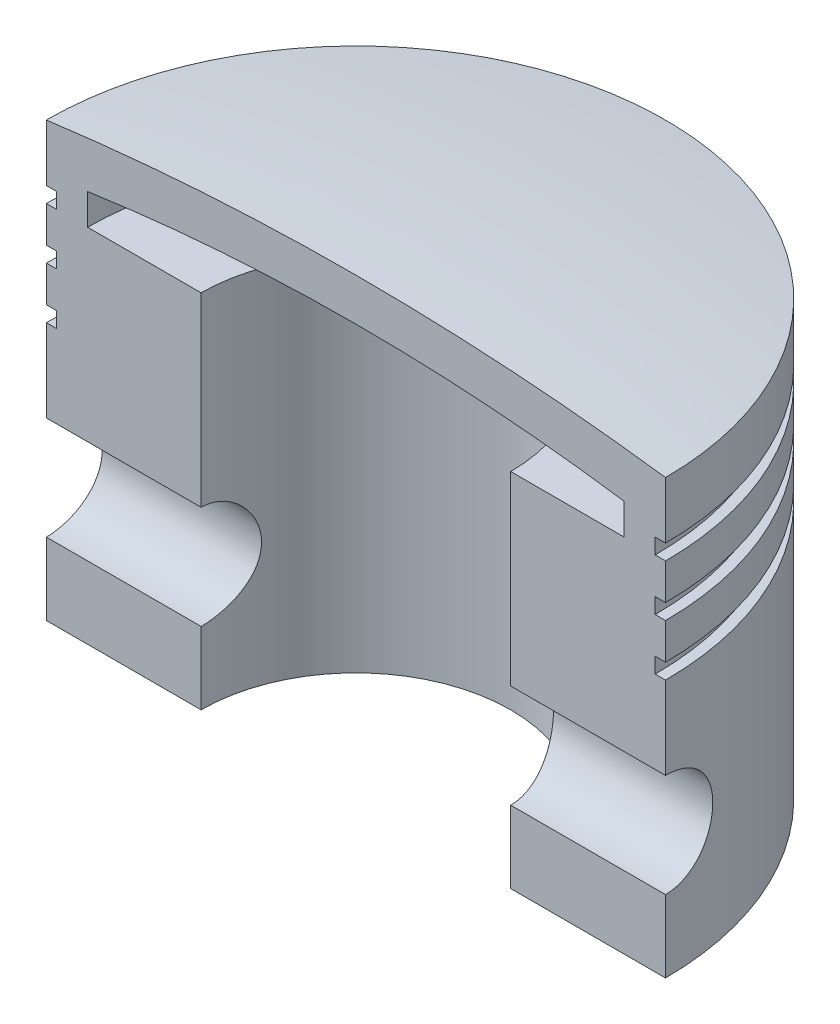
from build123d import *

# Parameters (mm, degrees)
CUT_EXTRUDE1_DEPTH      = 62.112017288
CUT_EXTRUDE1_DEPTH_BACK = 62.112017288
SKETCH2_R               = 5
SKETCH3_W               = 1
SKETCH3_H               = 1.5
SKETCH4_W               = 103.716801646
SKETCH4_H               = 65.276308729
CUT_EXTRUDE2_DEPTH      = 40


with BuildPart() as part:
    # Sketch1 → Revolve2 (revolve)
    with BuildSketch(Plane.XY):
        with BuildLine():
            Line((15, 35), (15, 0))
            Line((15, 0), (30, 0))
            Line((30, 0), (30, 42))
            ThreePointArc((30, 42), (15.03279876, 43.488194683), (0, 43.984982176))
            Line((0, 43.984982176), (0, 39.872478009))
            ThreePointArc((0, 39.872478009), (13.033669609, 39.403753083), (26, 38))
            Line((26, 38), (26, 35))
            Line((26, 35), (15, 35))
        make_face()
    revolve(axis=Axis((0, 45, 0), (0, 1, 0)))

    # Sketch2 → Cut-Extrude1 (cut, two sides: drawn at the far end of the back side and taken through both)
    with BuildSketch(Plane(origin=(0, 0, 0), x_dir=(0, 0, -1), z_dir=(1, 0, 0)).offset(-CUT_EXTRUDE1_DEPTH_BACK)):
        with Locations((0, 12)):
            Circle(SKETCH2_R)
    extrude(amount=CUT_EXTRUDE1_DEPTH + CUT_EXTRUDE1_DEPTH_BACK, mode=Mode.SUBTRACT)

    # Sketch3 → Cut-Revolve1 (revolve, cut)
    with BuildSketch(Plane(origin=(0, 0, 0), x_dir=(0, 0, -1), z_dir=(1, 0, 0))):
        with Locations((29.5, 35.75)):
            Rectangle(SKETCH3_W, SKETCH3_H)
        with Locations((29.5, 30.75)):
            Rectangle(SKETCH3_W, SKETCH3_H)
        with Locations((29.5, 25.75)):
            Rectangle(SKETCH3_W, SKETCH3_H)
    revolve(axis=Axis((0, 42, 0), (0, -1, 0)), mode=Mode.SUBTRACT)

    # Sketch4 → Cut-Extrude2 (cut)
    with BuildSketch(Plane.XY):
        with Locations((-0.592885071, 21.596736742)):
            Rectangle(SKETCH4_W, SKETCH4_H)
    extrude(amount=CUT_EXTRUDE2_DEPTH, mode=Mode.SUBTRACT)


solid = part.part
